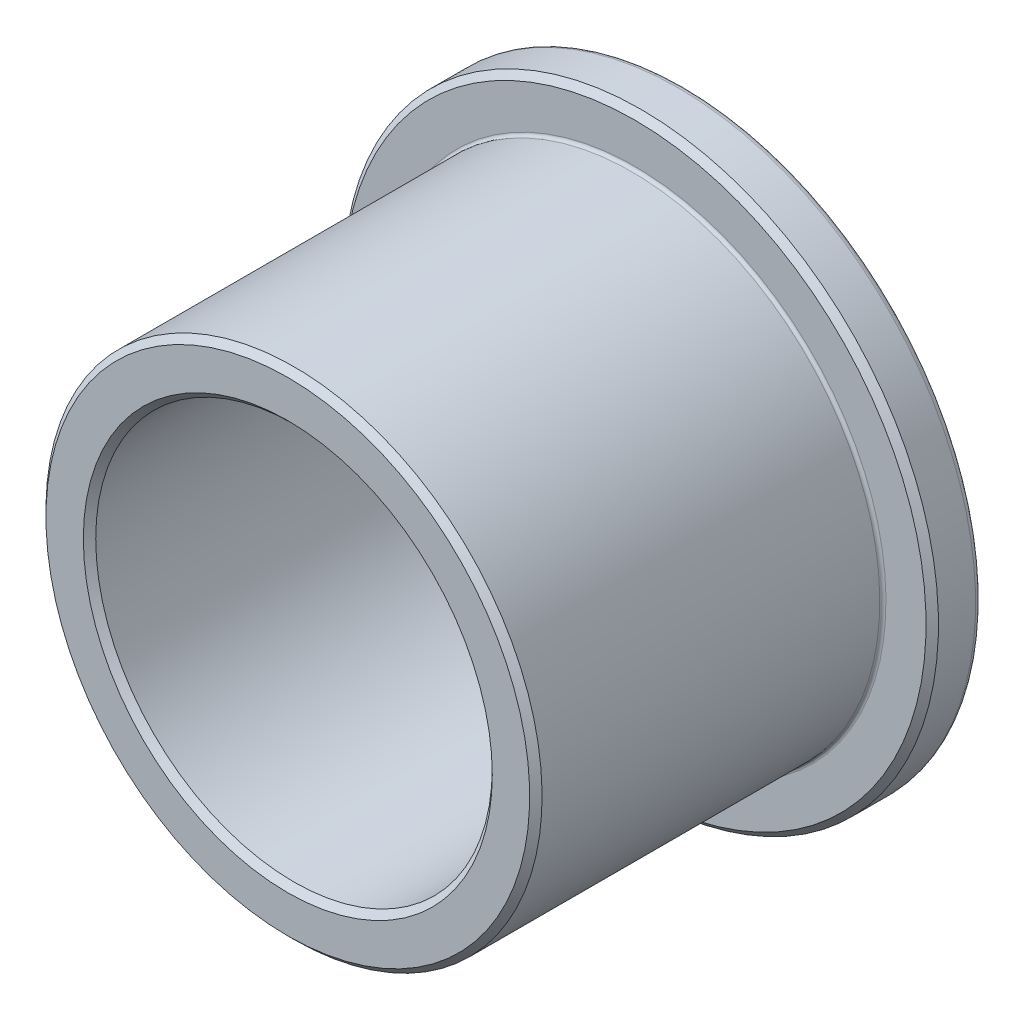
from build123d import *

# Parameters (mm, degrees)
CHAMFER1_SIZE = 0.396875
FILLET1_R     = 0.396875
FILLET2_R     = 0.1984375


with BuildPart() as part:
    # Sketch3 → Revolve1 (revolve)
    with BuildSketch(Plane(origin=(0, 0, 0), x_dir=(0, 0, -1), z_dir=(1, 0, 0))):
        Polygon((12.7, 19.05), (9.525, 19.05), (9.525, 15.8877), (-12.7, 15.8877), (-12.7, 12.7), (12.7, 12.7), align=None)
    revolve(axis=Axis((0, 0, -12.7), (0, 0, 1)))

    # Chamfer1
    chamfer1_edges = [part.edges().sort_by_distance(p)[0] for p in [
        (0, -12.7, 12.7),
        (0, -15.8877, 12.7),
        (0, -19.05, -9.525),
    ]]
    chamfer(chamfer1_edges, length=CHAMFER1_SIZE)

    # Fillet1
    fillet1_edges = [part.edges().sort_by_distance(p)[0] for p in [
        (0, -19.05, -12.7),
    ]]
    fillet(fillet1_edges, radius=FILLET1_R)

    # Fillet2
    fillet2_edges = [part.edges().sort_by_distance(p)[0] for p in [
        (0, -15.8877, -9.525),
    ]]
    fillet(fillet2_edges, radius=FILLET2_R)


solid = part.part
